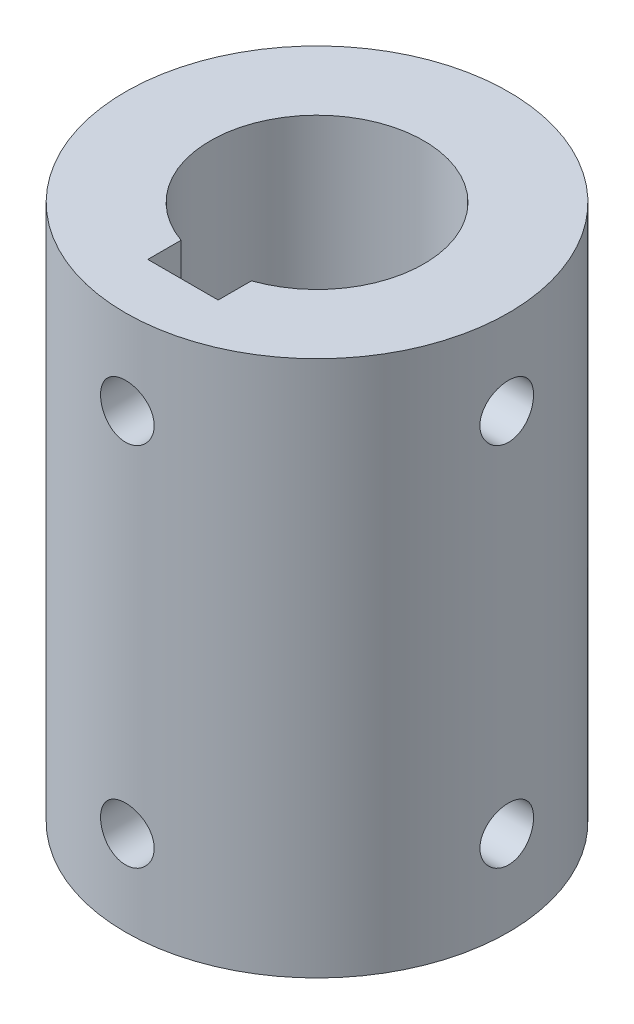
from build123d import *

# Parameters (mm, degrees)
SKETCH1_R               = 14.2875
BOSS_EXTRUDE1_DEPTH     = 40
CUT_EXTRUDE1_REACH      = 46.814
SKETCH2_R               = 6.3754
SKETCH3_R               = 7.9629
CUT_EXTRUDE2_DEPTH      = 20
CUT_EXTRUDE3_DEPTH      = 20
CUT_EXTRUDE4_REACH      = 46.814
CUT_EXTRUDE4_END_RADIUS = 14.2875
SKETCH5_R               = 2
CIRPATTERN1_COUNT       = 2
CIRPATTERN1_ANGLE       = 90


with BuildPart() as part:
    # Sketch1 → Boss-Extrude1 (new body)
    with BuildSketch(Plane(origin=(0, 0, 0), x_dir=(1, 0, 0), z_dir=(0, 1, 0))):
        with Locations(Location((0, 0, 0), (0, 0, 270))):
            Circle(SKETCH1_R)
    extrude(amount=BOSS_EXTRUDE1_DEPTH)

    # Sketch2 → Cut-Extrude1 (cut, up to next)
    with BuildSketch(Plane(origin=(0, 0, 0), x_dir=(-1, 0, 0), z_dir=(0, -1, 0)), mode=Mode.PRIVATE) as cut_extrude1_sk1:
        with Locations(Location((0, 0, 0), (0, 0, 90))):
            Circle(SKETCH2_R)
    cut_extrude1_tool1 = extrude(cut_extrude1_sk1.sketch, amount=-CUT_EXTRUDE1_REACH, mode=Mode.PRIVATE) & part.part
    add(cut_extrude1_tool1.solids().sort_by_distance((0, 0, 0))[0], mode=Mode.SUBTRACT)

    # Sketch3 → Cut-Extrude2 (cut)
    with BuildSketch(Plane(origin=(0, 40, 0), x_dir=(1, 0, 0), z_dir=(0, 1, 0))):
        with Locations(Location((0, 0, 0), (0, 0, 270))):
            Circle(SKETCH3_R)
    extrude(amount=-CUT_EXTRUDE2_DEPTH, mode=Mode.SUBTRACT)

    # Sketch4 → Cut-Extrude3 (cut)
    with BuildSketch(Plane(origin=(0, 40, 0), x_dir=(1, 0, 0), z_dir=(0, 1, 0))):
        with BuildLine():
            Line((2.625, -10), (-2.625, -10))
            Line((-2.625, -10), (-2.625, -7.517788997))
            ThreePointArc((-2.625, -7.517788997), (0, -7.9629), (2.625, -7.517788997))
            Line((2.625, -7.517788997), (2.625, -10))
        make_face()
    extrude(amount=-CUT_EXTRUDE3_DEPTH, mode=Mode.SUBTRACT)

    # Cut-Extrude4: up to this cylinder (the profile starts inside it)
    cut_extrude4_end = Plane(origin=(0, 20, 0), z_dir=(0, -1, 0)) * Cylinder(CUT_EXTRUDE4_END_RADIUS, 150.503, mode=Mode.PRIVATE)
    # Sketch5 → Cut-Extrude4 (cut, up to the surface)
    with BuildSketch(Plane.XY, mode=Mode.PRIVATE) as cut_extrude4_sk1:
        with Locations(Location((0, 33.65, 0), (0, 0, 180))):
            Circle(SKETCH5_R)
    cut_extrude4_tool1 = extrude(cut_extrude4_sk1.sketch, amount=CUT_EXTRUDE4_REACH, mode=Mode.PRIVATE) & cut_extrude4_end
    # Sketch5 → Cut-Extrude4 (cut, up to the surface)
    with BuildSketch(Plane.XY, mode=Mode.PRIVATE) as cut_extrude4_sk2:
        with Locations(Location((0, 6.35, 0), (0, 0, 180))):
            Circle(SKETCH5_R)
    cut_extrude4_tool2 = extrude(cut_extrude4_sk2.sketch, amount=CUT_EXTRUDE4_REACH, mode=Mode.PRIVATE) & cut_extrude4_end
    cut_extrude4 = cut_extrude4_tool1.solids().sort_by_distance((0, 33.65, 0))[0] + cut_extrude4_tool2.solids().sort_by_distance((0, 6.35, 0))[0]
    add(cut_extrude4, mode=Mode.SUBTRACT)

    # CirPattern1: Cut-Extrude4 ×2 about axis
    cirpattern1_axis = Axis((0, 40, 0), (0, 1, 0))
    for i in range(1, CIRPATTERN1_COUNT):
        add(cut_extrude4.rotate(cirpattern1_axis, i * CIRPATTERN1_ANGLE / (CIRPATTERN1_COUNT - 1)), mode=Mode.SUBTRACT)


solid = part.part
